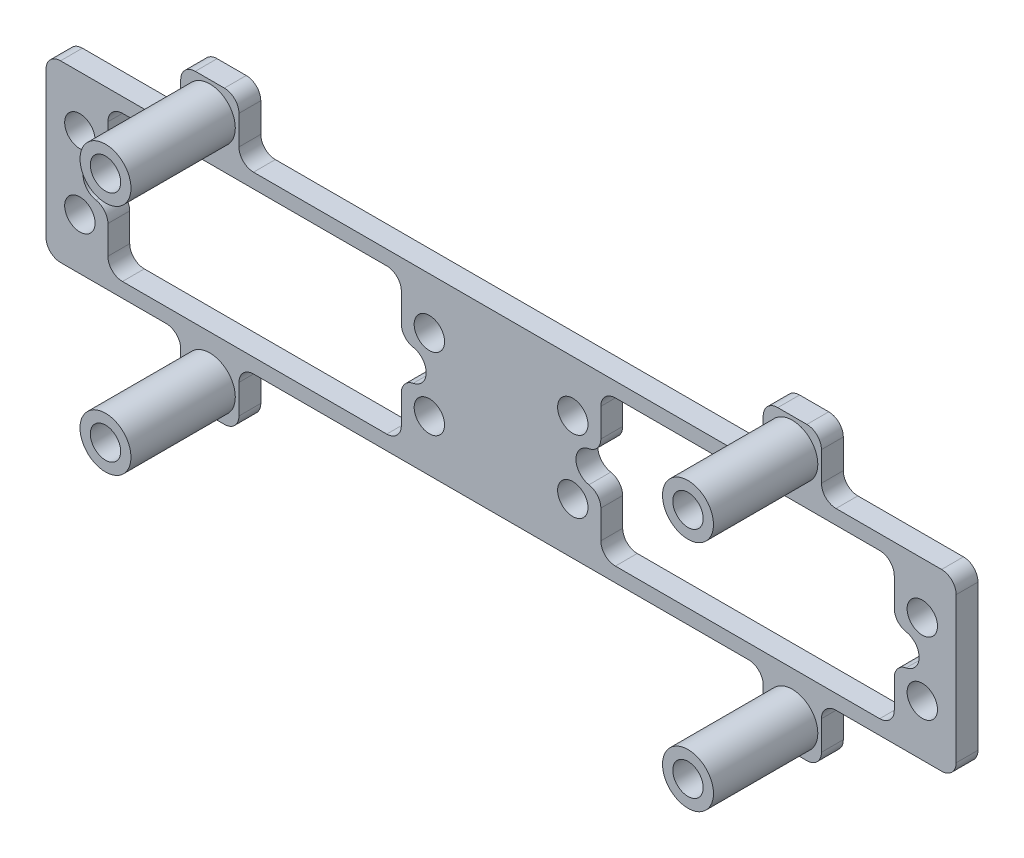
from build123d import *

# Parameters (mm, degrees)
SKETCH1_R           = 2.0875
BOSS_EXTRUDE1_DEPTH = 3
FILLET1_R           = 2
SKETCH2_R           = 3.5
SKETCH2_R_2         = 2.0875
BOSS_EXTRUDE2_DEPTH = 14.33


with BuildPart() as part:
    # Sketch1 → Boss-Extrude1 (new body)
    with BuildSketch(Plane.XY):
        Polygon((62.5, -12), (44, -12), (44, -20), (36, -20), (36, -12), (-36, -12), (-36, -20), (-44, -20), (-44, -12), (-62.5, -12), (-62.5, 12), (-44, 12), (-44, 20), (-36, 20), (-36, 12), (36, 12), (36, 20), (44, 20), (44, 12), (62.5, 12), align=None)
        with Locations((-40, 16)):
            Circle(SKETCH1_R, mode=Mode.SUBTRACT)
        with Locations((-57.85, 4.95)):
            Circle(SKETCH1_R, mode=Mode.SUBTRACT)
        with Locations((-57.85, -4.95)):
            Circle(SKETCH1_R, mode=Mode.SUBTRACT)
        with Locations((-9.85, 4.95)):
            Circle(SKETCH1_R, mode=Mode.SUBTRACT)
        with Locations((-9.85, -4.95)):
            Circle(SKETCH1_R, mode=Mode.SUBTRACT)
        with Locations((-40, -16)):
            Circle(SKETCH1_R, mode=Mode.SUBTRACT)
        with Locations((57.85, -4.95)):
            Circle(SKETCH1_R, mode=Mode.SUBTRACT)
        with Locations((57.85, 4.95)):
            Circle(SKETCH1_R, mode=Mode.SUBTRACT)
        with Locations((40, 16)):
            Circle(SKETCH1_R, mode=Mode.SUBTRACT)
        with Locations((40, -16)):
            Circle(SKETCH1_R, mode=Mode.SUBTRACT)
        with Locations((9.85, 4.95)):
            Circle(SKETCH1_R, mode=Mode.SUBTRACT)
        with Locations((9.85, -4.95)):
            Circle(SKETCH1_R, mode=Mode.SUBTRACT)
        with BuildLine():
            Line((54, -10), (13.7, -10))
            Line((13.7, -10), (13.7, -2.17975351))
            Line((13.7, -2.17975351), (12.46650234, -2.17975351))
            ThreePointArc((12.46650234, -2.17975351), (10.28674883, 0), (12.46650234, 2.17975351))
            Line((12.46650234, 2.17975351), (13.7, 2.17975351))
            Line((13.7, 2.17975351), (13.7, 10))
            Line((13.7, 10), (54, 10))
            Line((54, 10), (54, 2.17975351))
            Line((54, 2.17975351), (55.23349766, 2.17975351))
            ThreePointArc((55.23349766, 2.17975351), (57.41325117, 0), (55.23349766, -2.17975351))
            Line((55.23349766, -2.17975351), (54, -2.17975351))
            Line((54, -2.17975351), (54, -10))
        make_face(mode=Mode.SUBTRACT)
        with BuildLine():
            Line((-54, 10), (-13.7, 10))
            Line((-13.7, 10), (-13.7, 2.17975351))
            Line((-13.7, 2.17975351), (-12.46650234, 2.17975351))
            ThreePointArc((-12.46650234, 2.17975351), (-10.28674883, 0), (-12.46650234, -2.17975351))
            Line((-12.46650234, -2.17975351), (-13.7, -2.17975351))
            Line((-13.7, -2.17975351), (-13.7, -10))
            Line((-13.7, -10), (-54, -10))
            Line((-54, -10), (-54, -2.17975351))
            Line((-54, -2.17975351), (-55.23349766, -2.17975351))
            ThreePointArc((-55.23349766, -2.17975351), (-57.41325117, 0), (-55.23349766, 2.17975351))
            Line((-55.23349766, 2.17975351), (-54, 2.17975351))
            Line((-54, 2.17975351), (-54, 10))
        make_face(mode=Mode.SUBTRACT)
    extrude(amount=BOSS_EXTRUDE1_DEPTH)

    # Fillet1
    fillet1_edges = [part.edges().sort_by_distance(p)[0] for p in [
        (-54, -10, 1.5),
        (-13.7, -10, 1.5),
        (54, -10, 1.5),
        (13.7, -10, 1.5),
        (36, 12, 1.5),
        (36, 20, 1.5),
        (44, 20, 1.5),
        (62.5, -12, 1.5),
        (44, 12, 1.5),
        (62.5, 12, 1.5),
        (44, -20, 1.5),
        (44, -12, 1.5),
        (36, -20, 1.5),
        (36, -12, 1.5),
        (-36, -20, 1.5),
        (-36, -12, 1.5),
        (-44, -20, 1.5),
        (-62.5, -12, 1.5),
        (-44, -12, 1.5),
        (-62.5, 12, 1.5),
        (-44, 12, 1.5),
        (-44, 20, 1.5),
        (-36, 12, 1.5),
        (-36, 20, 1.5),
        (13.7, 2.17975351, 1.5),
        (13.7, -2.17975351, 1.5),
        (54, -2.17975351, 1.5),
        (54, 2.17975351, 1.5),
        (-13.7, -2.17975351, 1.5),
        (-13.7, 2.17975351, 1.5),
        (-54, -2.17975351, 1.5),
        (-54, 2.17975351, 1.5),
        (-54, 10, 1.5),
        (-13.7, 10, 1.5),
        (54, 10, 1.5),
        (13.7, 10, 1.5),
    ]]
    fillet(fillet1_edges, radius=FILLET1_R)

    # Sketch2 → Boss-Extrude2 (add)
    # profile 1 of 4: a face of its own
    with BuildSketch(Plane.XY.offset(3)):
        with Locations((-40, 16)):
            Circle(SKETCH2_R)
        with Locations((-40, 16)):
            Circle(SKETCH2_R_2, mode=Mode.SUBTRACT)
    # profile 2 of 4: a face of its own
    with BuildSketch(Plane.XY.offset(3)):
        with Locations(Location((-40, -16, 0), (0, 0, 180))):
            Circle(SKETCH2_R)
        with Locations(Location((-40, -16, 0), (0, 0, 180))):
            Circle(SKETCH2_R_2, mode=Mode.SUBTRACT)
    # profile 3 of 4: a face of its own
    with BuildSketch(Plane.XY.offset(3)):
        with Locations((40, -16)):
            Circle(SKETCH2_R)
        with Locations((40, -16)):
            Circle(SKETCH2_R_2, mode=Mode.SUBTRACT)
    # profile 4 of 4: a face of its own
    with BuildSketch(Plane.XY.offset(3)):
        with Locations(Location((40, 16, 0), (0, 0, 180))):
            Circle(SKETCH2_R)
        with Locations(Location((40, 16, 0), (0, 0, 180))):
            Circle(SKETCH2_R_2, mode=Mode.SUBTRACT)
    extrude(amount=BOSS_EXTRUDE2_DEPTH)


solid = part.part
